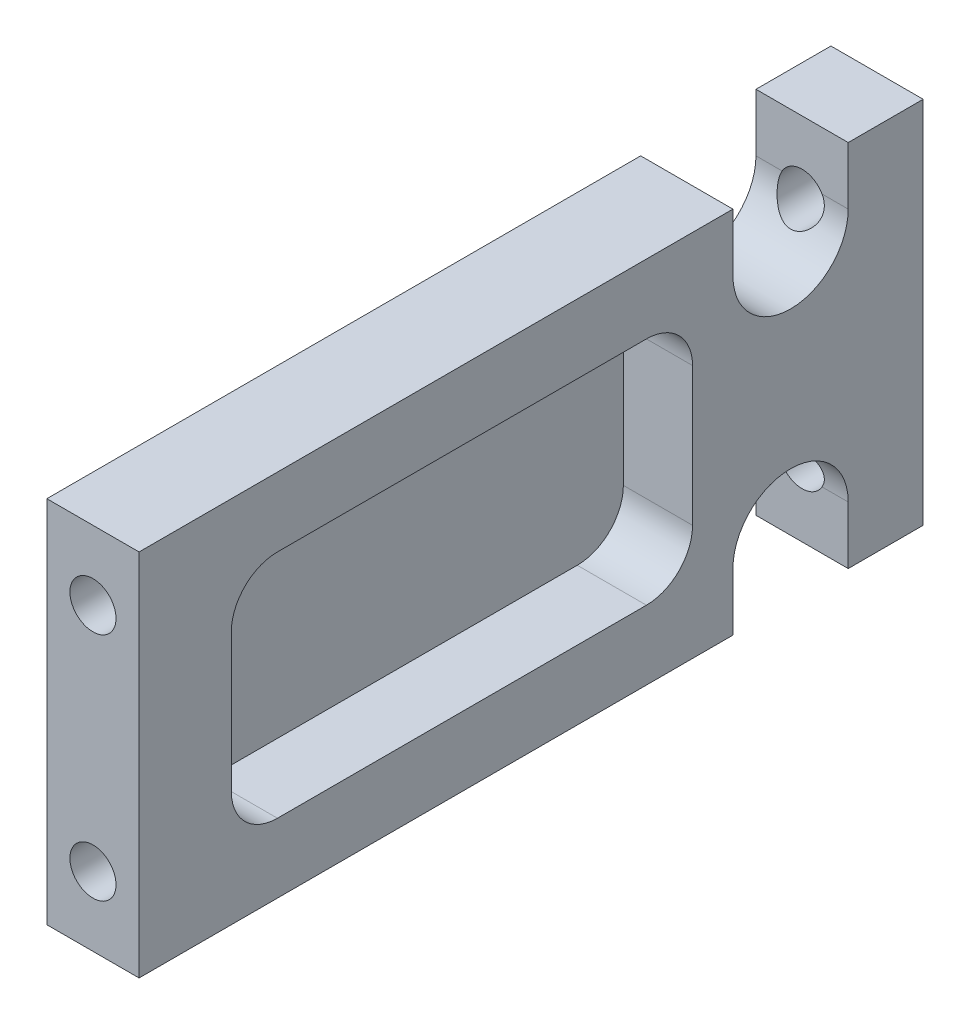
from build123d import *

# Parameters (mm, degrees)
SKETCH1_W          = 107.95
SKETCH1_H          = 50.8
EXTRUDE1_DEPTH     = 12.7
SKETCH2_W          = 63.5
SKETCH2_H          = 31.75
CUT_EXTRUDE1_DEPTH = 9.525
FILLET1_R          = 6.35
CUT_EXTRUDE2_DEPTH = 120.979717036
SKETCH4_R          = 3.175
CUT_EXTRUDE3_DEPTH = 15.875
CUT_EXTRUDE4_REACH = 121.98
SKETCH5_R          = 3.175


with BuildPart() as part:
    # Sketch1 → Extrude1 (new body)
    with BuildSketch(Plane(origin=(0, 0, 0), x_dir=(0, 0, -1), z_dir=(1, 0, 0))):
        with Locations((53.975, 25.4)):
            Rectangle(SKETCH1_W, SKETCH1_H)
    extrude(amount=EXTRUDE1_DEPTH)

    # Sketch2 → Cut-Extrude1 (cut)
    with BuildSketch(Plane(origin=(12.7, 0, 0), x_dir=(0, 0, -1), z_dir=(1, 0, 0))):
        with Locations((44.45, 25.4)):
            Rectangle(SKETCH2_W, SKETCH2_H)
    extrude(amount=-CUT_EXTRUDE1_DEPTH, mode=Mode.SUBTRACT)

    # Fillet1
    fillet1_edges = [part.edges().sort_by_distance(p)[0] for p in [
        (7.9375, 9.525, -12.7),
        (7.9375, 41.275, -12.7),
        (7.9375, 41.275, -76.2),
        (7.9375, 9.525, -76.2),
    ]]
    fillet(fillet1_edges, radius=FILLET1_R)

    # Sketch3 → Cut-Extrude2 (cut, through all)
    with BuildSketch(Plane(origin=(12.7, 0, 0), x_dir=(0, 0, -1), z_dir=(1, 0, 0))):
        with BuildLine():
            Line((97.63125, 50.8), (81.75625, 50.8))
            Line((81.75625, 50.8), (81.75625, 42.8625))
            ThreePointArc((81.75625, 42.8625), (89.69375, 34.925), (97.63125, 42.8625))
            Line((97.63125, 42.8625), (97.63125, 50.8))
        make_face()
        with BuildLine():
            Line((97.63125, 0), (81.75625, 0))
            Line((81.75625, 0), (81.75625, 7.9375))
            ThreePointArc((81.75625, 7.9375), (89.69375, 15.875), (97.63125, 7.9375))
            Line((97.63125, 7.9375), (97.63125, 0))
        make_face()
    extrude(amount=-CUT_EXTRUDE2_DEPTH, mode=Mode.SUBTRACT)

    # Sketch4 → Cut-Extrude3 (cut)
    with BuildSketch(Plane.XY):
        with Locations((6.35, 41.275)):
            Circle(SKETCH4_R)
        with Locations((6.35, 9.525)):
            Circle(SKETCH4_R)
    extrude(amount=-CUT_EXTRUDE3_DEPTH, mode=Mode.SUBTRACT)

    # Sketch5 → Cut-Extrude4 (cut, up to next)
    with BuildSketch(Plane(origin=(0, 0, -107.95), x_dir=(-1, 0, 0), z_dir=(0, 0, -1)), mode=Mode.PRIVATE) as cut_extrude4_sk1:
        with Locations(Location((-6.35, 41.275, 0), (0, 0, 180))):
            Circle(SKETCH5_R)
    cut_extrude4_tool1 = extrude(cut_extrude4_sk1.sketch, amount=-CUT_EXTRUDE4_REACH, mode=Mode.PRIVATE) & part.part
    # Sketch5 → Cut-Extrude4 (cut, up to next)
    with BuildSketch(Plane(origin=(0, 0, -107.95), x_dir=(-1, 0, 0), z_dir=(0, 0, -1)), mode=Mode.PRIVATE) as cut_extrude4_sk2:
        with Locations(Location((-6.35, 9.525, 0), (0, 0, 180))):
            Circle(SKETCH5_R)
    cut_extrude4_tool2 = extrude(cut_extrude4_sk2.sketch, amount=-CUT_EXTRUDE4_REACH, mode=Mode.PRIVATE) & part.part
    add(cut_extrude4_tool1.solids().sort_by_distance((6.35, 41.275, -107.95))[0], mode=Mode.SUBTRACT)
    add(cut_extrude4_tool2.solids().sort_by_distance((6.35, 9.525, -107.95))[0], mode=Mode.SUBTRACT)


solid = part.part
